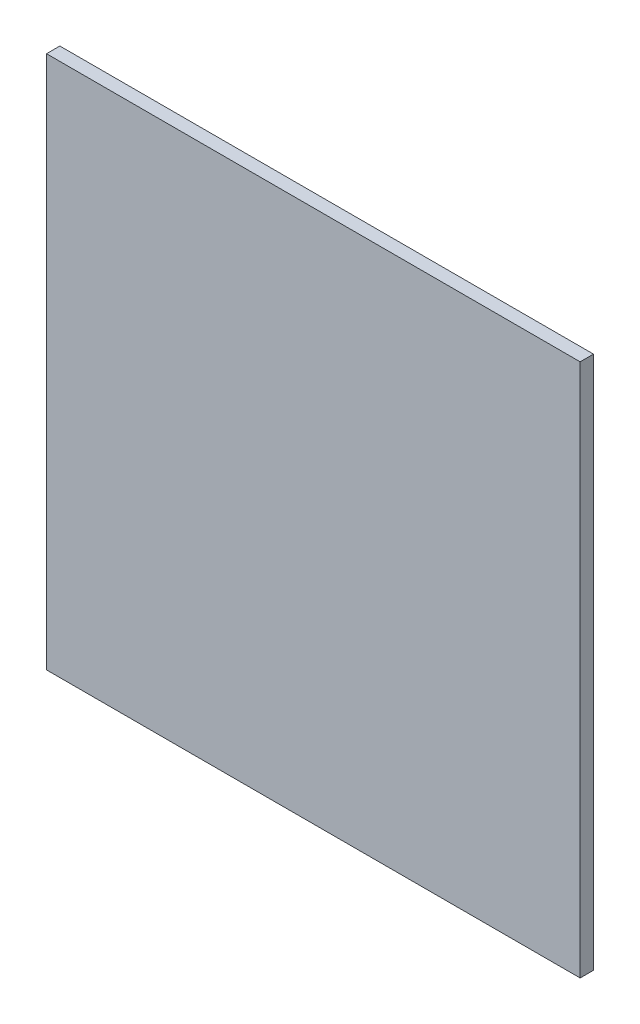
from build123d import *

# Parameters (mm, degrees)
SKETCH_1_W      = 20
SKETCH_1_H      = 20
EXTRUDE_1_DEPTH = 0.5


with BuildPart() as part:
    # 草图1 → 凸台-拉伸1 (new body)
    with BuildSketch(Plane.XY):
        with Locations((10, 10)):
            Rectangle(SKETCH_1_W, SKETCH_1_H)
    extrude(amount=EXTRUDE_1_DEPTH)


solid = part.part
